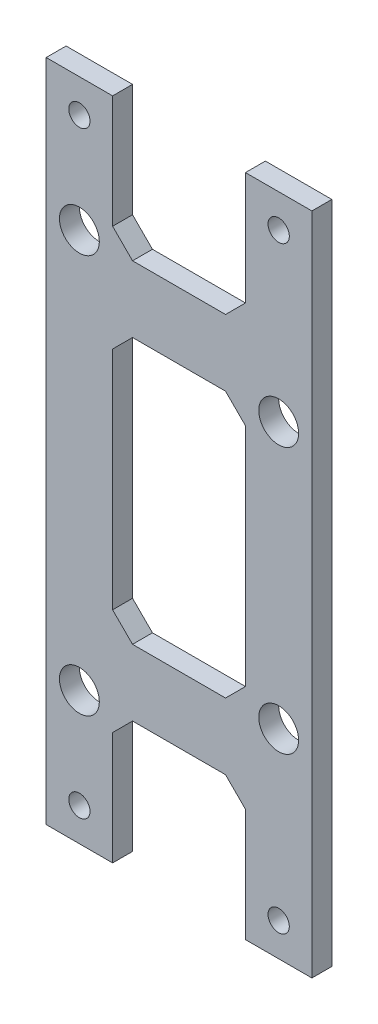
from build123d import *

# Parameters (mm, degrees)
SKETCH_1_W          = 40
SKETCH_1_H          = 100
SKETCH_1_R          = 1.6
SKETCH_1_R_2        = 3
EXTRUDE_1_DEPTH     = 3
SKETCH_2_W          = 20
SKETCH_2_H          = 20
CUT_EXTRUDE_1_DEPTH = 108.745069493
SKETCH_3_W          = 20
SKETCH_3_H          = 40
CUT_EXTRUDE_2_DEPTH = 10
CHAMFER_1_SIZE      = 3


with BuildPart() as part:
    # ｽｹｯﾁ1 → ﾎﾞｽ - 押し出し1 (new body)
    with BuildSketch(Plane.XY):
        with Locations((20, 50)):
            Rectangle(SKETCH_1_W, SKETCH_1_H)
        with Locations((5, 95)):
            Circle(SKETCH_1_R, mode=Mode.SUBTRACT)
        with Locations((35, 95)):
            Circle(SKETCH_1_R, mode=Mode.SUBTRACT)
        with Locations((5, 80)):
            Circle(SKETCH_1_R_2, mode=Mode.SUBTRACT)
        with Locations((35, 70)):
            Circle(SKETCH_1_R_2, mode=Mode.SUBTRACT)
        with Locations((5, 20)):
            Circle(SKETCH_1_R_2, mode=Mode.SUBTRACT)
        with Locations((35, 30)):
            Circle(SKETCH_1_R_2, mode=Mode.SUBTRACT)
        with Locations((5, 5)):
            Circle(SKETCH_1_R, mode=Mode.SUBTRACT)
        with Locations((35, 5)):
            Circle(SKETCH_1_R, mode=Mode.SUBTRACT)
    extrude(amount=EXTRUDE_1_DEPTH)

    # ｽｹｯﾁ2 → ｶｯﾄ - 押し出し1 (cut, through all)
    with BuildSketch(Plane.XY.offset(3)):
        with Locations((20, 90)):
            Rectangle(SKETCH_2_W, SKETCH_2_H)
        with Locations((20, 10)):
            Rectangle(SKETCH_2_W, SKETCH_2_H)
    extrude(amount=-CUT_EXTRUDE_1_DEPTH, mode=Mode.SUBTRACT)

    # ｽｹｯﾁ3 → ｶｯﾄ - 押し出し2 (cut)
    with BuildSketch(Plane.XY.offset(3)):
        with Locations((20, 50)):
            Rectangle(SKETCH_3_W, SKETCH_3_H)
    extrude(amount=-CUT_EXTRUDE_2_DEPTH, mode=Mode.SUBTRACT)

    # 面取り1
    chamfer_1_edges = [part.edges().sort_by_distance(p)[0] for p in [
        (10, 80, 1.5),
        (30, 80, 1.5),
        (10, 20, 1.5),
        (30, 20, 1.5),
        (30, 70, 1.5),
        (30, 30, 1.5),
        (10, 30, 1.5),
        (10, 70, 1.5),
    ]]
    chamfer(chamfer_1_edges, length=CHAMFER_1_SIZE)


solid = part.part
